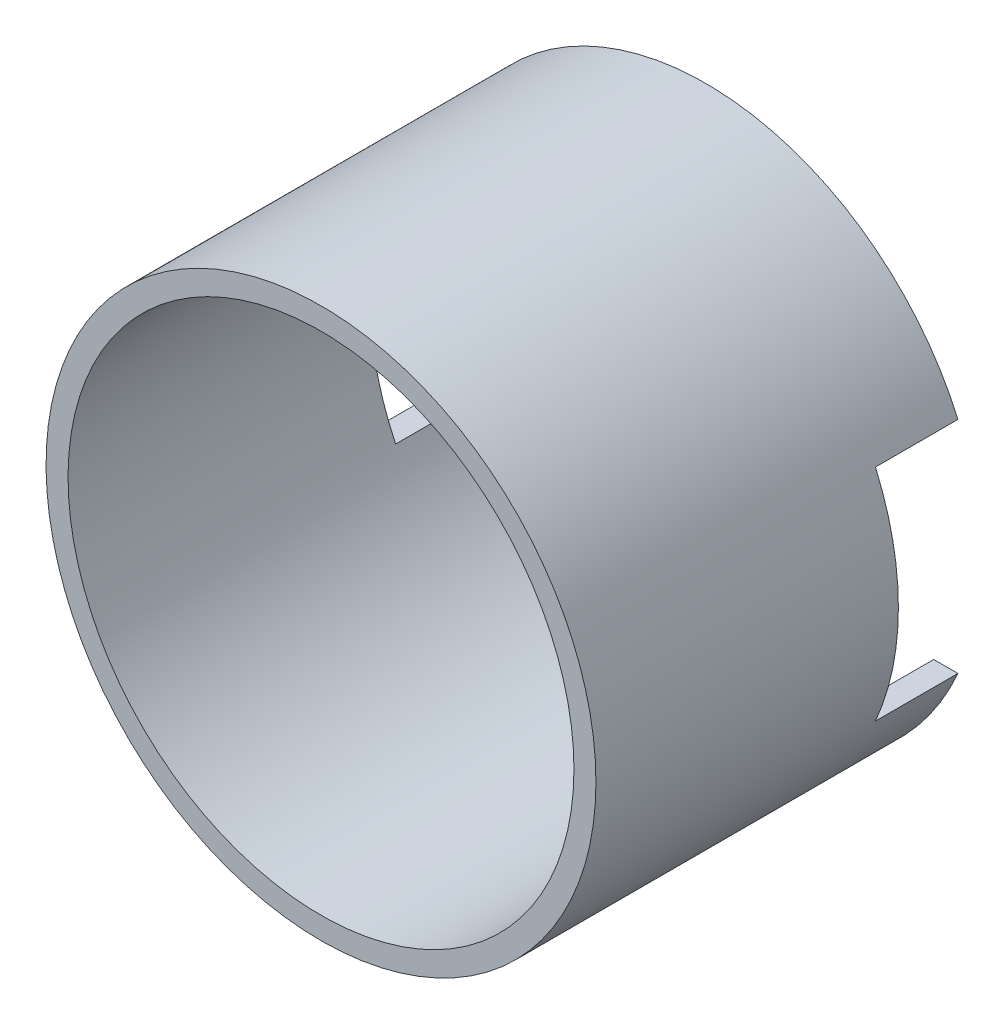
from build123d import *

# Parameters (mm, degrees)
SKETCH_1_R               = 15
SKETCH_1_R_2             = 13.8
EXTRUDE_1_DEPTH          = 21
CUT_EXTRUDE_1_DEPTH      = 21
CUT_EXTRUDE_1_DEPTH_BACK = 21
SKETCH_2_W               = 9
SKETCH_2_H               = 12


with BuildPart() as part:
    # Эскиз1 → Бобышка-Вытянуть1 (new body)
    with BuildSketch(Plane.XY):
        Circle(SKETCH_1_R)
        Circle(SKETCH_1_R_2, mode=Mode.SUBTRACT)
    extrude(amount=EXTRUDE_1_DEPTH)

    # Эскиз2 → Вырез-Вытянуть1 (cut, two sides: drawn at the far end of the back side and taken through both)
    with BuildSketch(Plane(origin=(0, 0, 0), x_dir=(0, 0, -1), z_dir=(1, 0, 0)).offset(-CUT_EXTRUDE_1_DEPTH_BACK)):
        Rectangle(SKETCH_2_W, SKETCH_2_H)
    extrude(amount=CUT_EXTRUDE_1_DEPTH + CUT_EXTRUDE_1_DEPTH_BACK, mode=Mode.SUBTRACT)


solid = part.part
